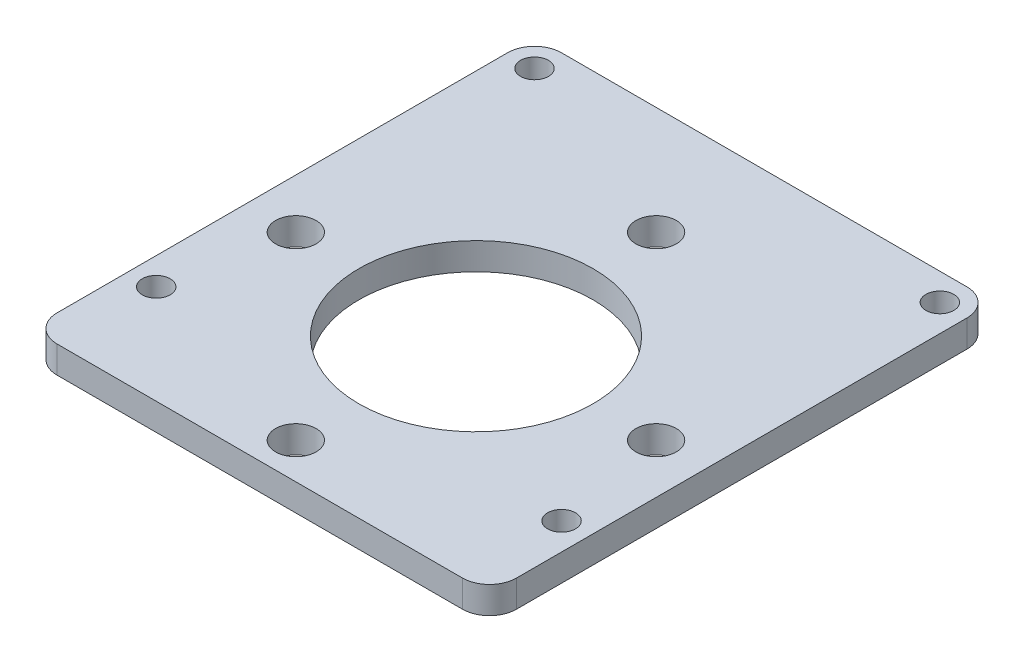
from build123d import *

# Parameters (mm, degrees)
SKETCH1_R         = 1.55
SKETCH1_R_2       = 2.25
SKETCH1_R_3       = 13
MOTOR_PLATE_DEPTH = 3


with BuildPart() as part:
    # Sketch1 → Motor_Plate (new body)
    with BuildSketch(Plane(origin=(0, 0, 0), x_dir=(1, 0, 0), z_dir=(0, 1, 0))):
        with BuildLine():
            Line((25.5, -29), (25.5, 21))
            ThreePointArc((25.5, 21), (24.621320344, 23.121320344), (22.5, 24))
            Line((22.5, 24), (-22.5, 24))
            ThreePointArc((-22.5, 24), (-24.621320344, 23.121320344), (-25.5, 21))
            Line((-25.5, 21), (-25.5, -29))
            ThreePointArc((-25.5, -29), (-24.621320344, -31.121320344), (-22.5, -32))
            Line((-22.5, -32), (22.5, -32))
            ThreePointArc((22.5, -32), (24.621320344, -31.121320344), (25.5, -29))
        make_face()
        with Locations(Location((22.5, -21, 0), (0, 0, 270))):
            Circle(SKETCH1_R, mode=Mode.SUBTRACT)
        with Locations(Location((-22.5, -21, 0), (0, 0, 270))):
            Circle(SKETCH1_R, mode=Mode.SUBTRACT)
        with Locations(Location((0, -28, 0), (0, 0, 270))):
            Circle(SKETCH1_R_2, mode=Mode.SUBTRACT)
        with Locations(Location((0, 12, 0), (0, 0, 270))):
            Circle(SKETCH1_R_2, mode=Mode.SUBTRACT)
        with Locations(Location((-22.5, 21, 0), (0, 0, 270))):
            Circle(SKETCH1_R, mode=Mode.SUBTRACT)
        with Locations(Location((20, -8, 0), (0, 0, 270))):
            Circle(SKETCH1_R_2, mode=Mode.SUBTRACT)
        with Locations(Location((22.5, 21, 0), (0, 0, 270))):
            Circle(SKETCH1_R, mode=Mode.SUBTRACT)
        with Locations(Location((-20, -8, 0), (0, 0, 270))):
            Circle(SKETCH1_R_2, mode=Mode.SUBTRACT)
        with Locations(Location((0, -8, 0), (0, 0, 270))):
            Circle(SKETCH1_R_3, mode=Mode.SUBTRACT)
    extrude(amount=MOTOR_PLATE_DEPTH)


solid = part.part
